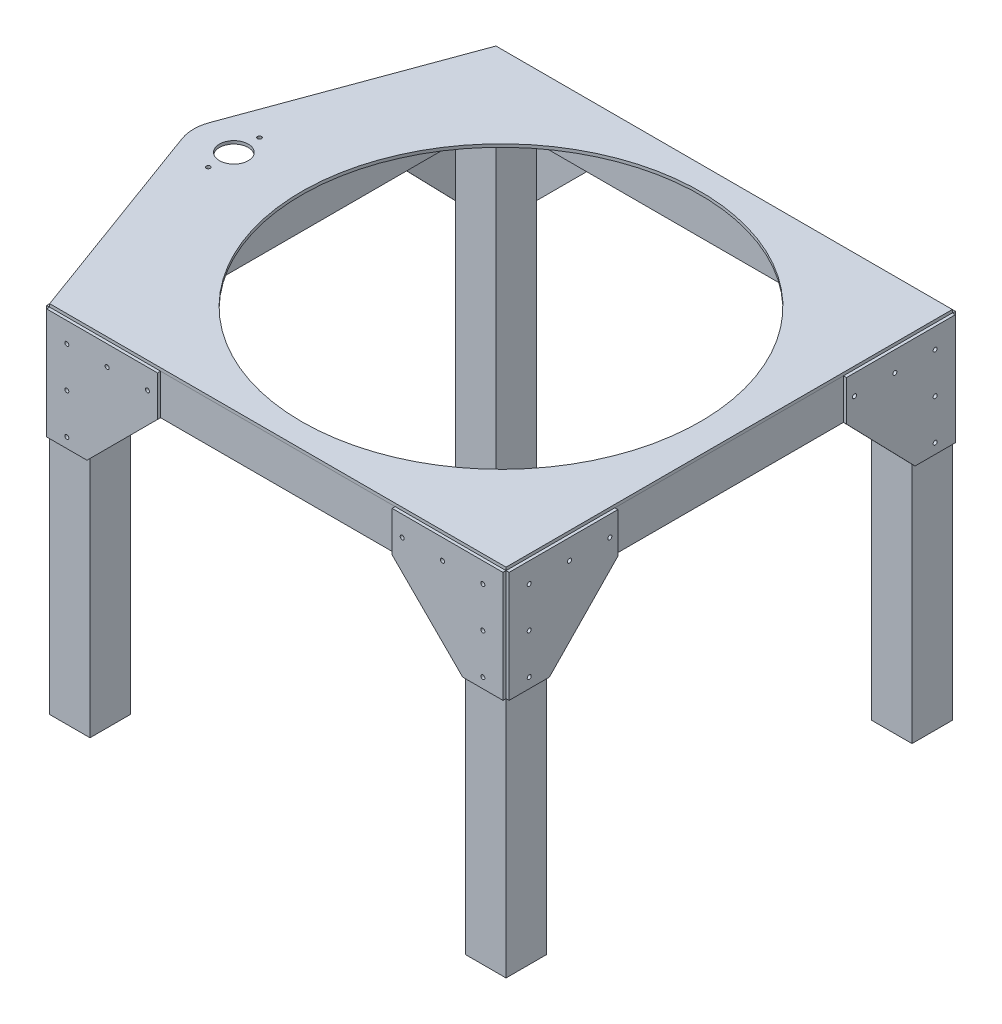
from build123d import *

# Parameters (mm, degrees)
SKETCH5_R           = 14.29
SKETCH5_R_2         = 2
SKETCH5_R_3         = 197.792337932
BOSS_EXTRUDE1_DEPTH = 3
SKETCH6_W           = 40
SKETCH6_H           = 40
SKETCH6_W_2         = 36
SKETCH6_H_2         = 36
BOSS_EXTRUDE2_DEPTH = 350
SKETCH8_W           = 20
SKETCH8_H           = 40
SKETCH8_W_2         = 16
SKETCH8_H_2         = 36
BOSS_EXTRUDE3_DEPTH = 372.759675864
SKETCH9_W           = 20
SKETCH9_H           = 40
SKETCH9_W_2         = 16
SKETCH9_H_2         = 36
BOSS_EXTRUDE4_DEPTH = 362.759675864
SKETCH10_R          = 2
BOSS_EXTRUDE5_DEPTH = 3
SKETCH11_R          = 2
BOSS_EXTRUDE6_DEPTH = 3


with BuildPart() as part:
    # Sketch5 → Boss-Extrude1 (new body)
    with BuildSketch(Plane(origin=(0, 0, 0), x_dir=(1, 0, 0), z_dir=(0, 1, 0))):
        with BuildLine():
            Line((-302.552030607, 13.778425066), (-226.379837932, 221.379837932))
            Line((-226.379837932, 221.379837932), (-186.379837932, 221.379837932))
            Line((-186.379837932, 221.379837932), (186.379837932, 221.379837932))
            Line((186.379837932, 221.379837932), (226.379837932, 221.379837932))
            Line((226.379837932, 221.379837932), (226.379837932, 181.379837932))
            Line((226.379837932, 181.379837932), (226.379837932, -181.379837932))
            Line((226.379837932, -181.379837932), (226.379837932, -221.379837932))
            Line((226.379837932, -221.379837932), (186.379837932, -221.379837932))
            Line((186.379837932, -221.379837932), (-186.379837932, -221.379837932))
            Line((-186.379837932, -221.379837932), (-226.379837932, -221.379837932))
            Line((-226.379837932, -221.379837932), (-302.552030607, -13.778425066))
            ThreePointArc((-302.552030607, -13.778425066), (-305, 0), (-302.552030607, 13.778425066))
        make_face()
        with Locations(Location((-265, 0, 0), (0, 0, 270))):
            Circle(SKETCH5_R, mode=Mode.SUBTRACT)
        with Locations(Location((-265, -25.4, 0), (0, 0, 270))):
            Circle(SKETCH5_R_2, mode=Mode.SUBTRACT)
        with Locations(Location((-265, 25.4, 0), (0, 0, 270))):
            Circle(SKETCH5_R_2, mode=Mode.SUBTRACT)
        with Locations(Location((0, 0, 0), (0, 0, 270))):
            Circle(SKETCH5_R_3, mode=Mode.SUBTRACT)
    extrude(amount=BOSS_EXTRUDE1_DEPTH)


with BuildPart() as body_2:
    # Sketch6 → Boss-Extrude2 (new body)
    with BuildSketch(Plane.XZ):
        with Locations((206.379837932, 201.379837932)):
            Rectangle(SKETCH6_W, SKETCH6_H)
        with Locations((206.379837932, 201.379837932)):
            Rectangle(SKETCH6_W_2, SKETCH6_H_2, mode=Mode.SUBTRACT)
    extrude(amount=BOSS_EXTRUDE2_DEPTH)


with BuildPart() as body_3:
    # Mirror2: mirrored copy
    add(body_2.part.mirror(Plane(origin=(0, 0, 0), x_dir=(0, 0, 1), z_dir=(1, 0, 0))))


with BuildPart() as body_4:
    # Mirror3: mirrored copy
    add(body_2.part.mirror(Plane.XY))


with BuildPart() as body_5:
    # Mirror3 2: mirrored copy
    add(body_3.part.mirror(Plane.XY))


with BuildPart() as body_6:
    # Sketch8 → Boss-Extrude3 (new body)
    with BuildSketch(Plane.ZY.offset(-186.379837932)):
        with Locations((-211.379837932, -20)):
            Rectangle(SKETCH8_W, SKETCH8_H)
        with Locations((-211.379837932, -20)):
            Rectangle(SKETCH8_W_2, SKETCH8_H_2, mode=Mode.SUBTRACT)
    extrude(amount=BOSS_EXTRUDE3_DEPTH)


with BuildPart() as body_7:
    # Mirror4: mirrored copy
    add(body_6.part.mirror(Plane.XY))


with BuildPart() as body_8:
    # Sketch9 → Boss-Extrude4 (new body)
    with BuildSketch(Plane.XY.offset(-181.379837932)):
        with Locations((216.379837932, -20)):
            Rectangle(SKETCH9_W, SKETCH9_H)
        with Locations((216.379837932, -20)):
            Rectangle(SKETCH9_W_2, SKETCH9_H_2, mode=Mode.SUBTRACT)
    extrude(amount=BOSS_EXTRUDE4_DEPTH)


with BuildPart() as body_9:
    # Mirror6: mirrored copy
    add(body_8.part.mirror(Plane(origin=(0, 0, 0), x_dir=(0, 0, 1), z_dir=(1, 0, 0))))


with BuildPart() as body_10:
    # Sketch10 → Boss-Extrude5 (new body)
    # profile 1 of 2: a face of its own
    with BuildSketch(Plane(origin=(0, 0, -221.379837932), x_dir=(-1, 0, 0), z_dir=(0, 0, -1))):
        Polygon((226.379837932, -110), (226.379837932, 0), (186.379837932, 0), (186.379837932, -40), (186.379837932, -110), align=None)
        with Locations((206.379837932, -100)):
            Circle(SKETCH10_R, mode=Mode.SUBTRACT)
        with Locations((206.379837932, -60)):
            Circle(SKETCH10_R, mode=Mode.SUBTRACT)
        with Locations((206.379837932, -20)):
            Circle(SKETCH10_R, mode=Mode.SUBTRACT)
    # profile 2 of 2: a face of its own
    with BuildSketch(Plane(origin=(0, 0, -221.379837932), x_dir=(-1, 0, 0), z_dir=(0, 0, -1))):
        Polygon((186.379837932, -40), (186.379837932, 0), (116.379837932, 0), (116.379837932, -40), (186.379837932, -110), align=None)
        with Locations((126.379837932, -20)):
            Circle(SKETCH10_R, mode=Mode.SUBTRACT)
        with Locations((166.379837932, -20)):
            Circle(SKETCH10_R, mode=Mode.SUBTRACT)
    extrude(amount=BOSS_EXTRUDE5_DEPTH)


with BuildPart() as body_11:
    # Sketch11 → Boss-Extrude6 (new body)
    with BuildSketch(Plane.ZY.offset(226.379837932)):
        Polygon((-113.379837932, -40), (-113.379837932, 0), (-221.379837932, 0), (-221.379837932, -110), (-181.379837932, -110), align=None)
        with Locations((-201.379837932, -100)):
            Circle(SKETCH11_R, mode=Mode.SUBTRACT)
        with Locations((-201.379837932, -60)):
            Circle(SKETCH11_R, mode=Mode.SUBTRACT)
        with Locations((-201.379837932, -20)):
            Circle(SKETCH11_R, mode=Mode.SUBTRACT)
        with Locations((-121.379837932, -20)):
            Circle(SKETCH11_R, mode=Mode.SUBTRACT)
        with Locations((-161.379837932, -20)):
            Circle(SKETCH11_R, mode=Mode.SUBTRACT)
    extrude(amount=BOSS_EXTRUDE6_DEPTH)


with BuildPart() as body_12:
    # Mirror7: mirrored copy
    add(body_11.part.mirror(Plane.XY))


with BuildPart() as body_13:
    # Mirror8: mirrored copy
    add(body_11.part.mirror(Plane(origin=(0, 0, 0), x_dir=(0, 0, 1), z_dir=(1, 0, 0))))


with BuildPart() as body_14:
    # Mirror8 2: mirrored copy
    add(body_12.part.mirror(Plane(origin=(0, 0, 0), x_dir=(0, 0, 1), z_dir=(1, 0, 0))))


with BuildPart() as body_15:
    # Mirror9: mirrored copy
    add(body_10.part.mirror(Plane(origin=(0, 0, 0), x_dir=(0, 0, 1), z_dir=(1, 0, 0))))


with BuildPart() as body_16:
    # Mirror10: mirrored copy
    add(body_15.part.mirror(Plane.XY))


with BuildPart() as body_17:
    # Mirror10 2: mirrored copy
    add(body_10.part.mirror(Plane.XY))


solid = Compound([part.part, body_2.part, body_3.part, body_4.part, body_5.part, body_6.part, body_7.part, body_8.part, body_9.part, body_10.part, body_11.part, body_12.part, body_13.part, body_14.part, body_15.part, body_16.part, body_17.part])
